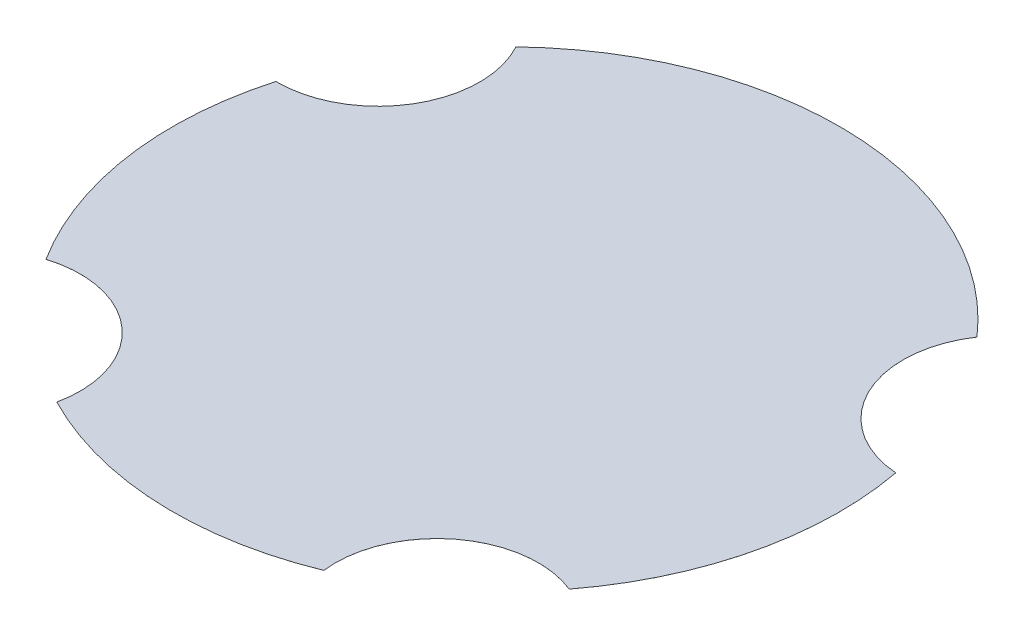
from build123d import *

# Parameters (mm, degrees)
BOSS_EXTRUDE1_DEPTH = 0.001


with BuildPart() as part:
    # Sketch1 → Boss-Extrude1 (new body)
    with BuildSketch(Plane(origin=(0, 0, 0), x_dir=(-1, 0, 0), z_dir=(0, 1, 0))):
        with BuildLine():
            ThreePointArc((37.937647791, -4.913544121), (28.70926798, -10.08205757), (28.487727315, -20.656907212))
            ThreePointArc((28.487727315, -20.656907212), (2.7449968, -30.370584607), (-22.0648502, -18.474568686))
            ThreePointArc((-22.0648502, -18.474568686), (-21.334652462, -7.855628264), (-30.141411051, -1.877661419))
            ThreePointArc((-30.141411051, -1.877661419), (-29.80188839, 12.669046316), (-23.576249564, 25.820601462))
            ThreePointArc((-23.576249564, 25.820601462), (-13.094194308, 27.235890416), (-9.001786871, 36.989286059))
            ThreePointArc((-9.001786871, 36.989286059), (5.789984426, 39.563151009), (20.299205364, 35.702608737))
            ThreePointArc((20.299205364, 35.702608737), (23.520918673, 25.628032391), (33.838568344, 23.299378169))
            ThreePointArc((33.838568344, 23.299378169), (38.890862153, 9.629189716), (37.937647791, -4.913544121))
        make_face()
    extrude(amount=BOSS_EXTRUDE1_DEPTH)


solid = part.part
